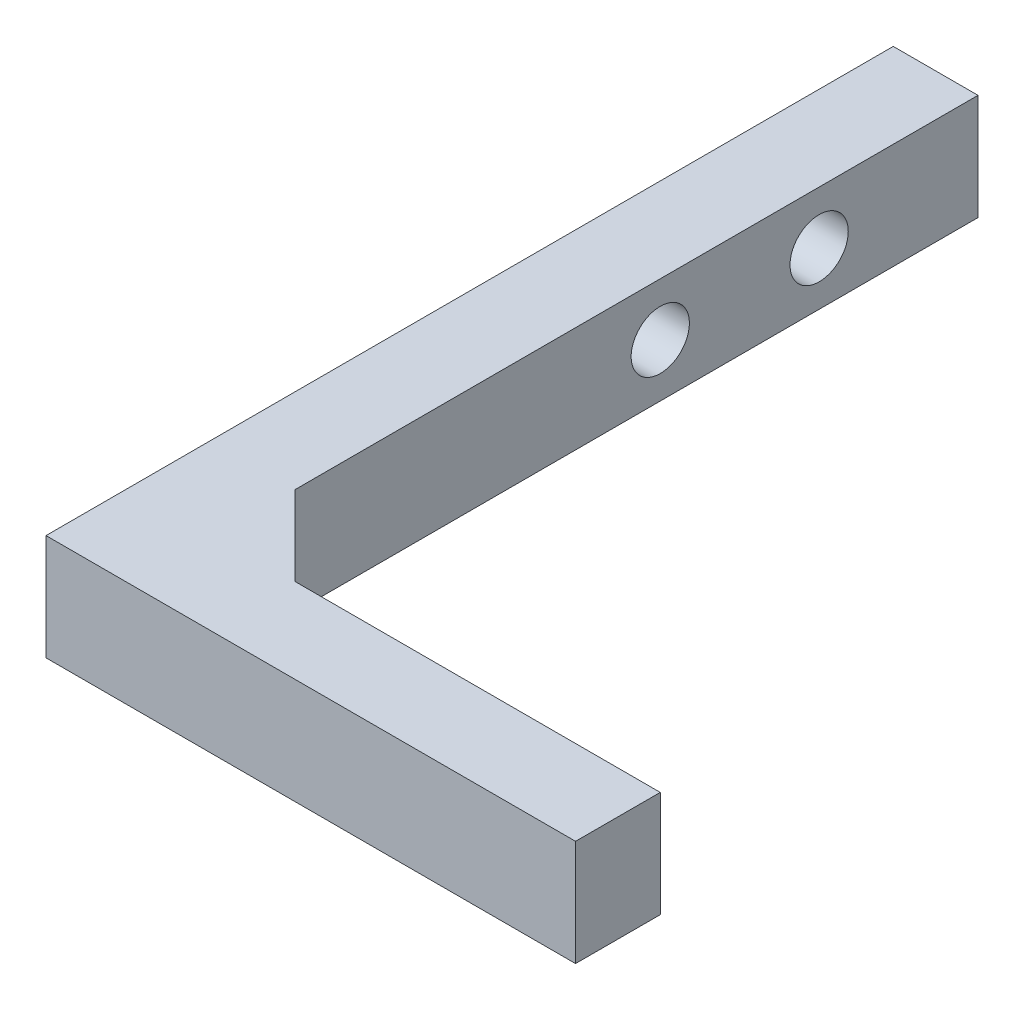
from build123d import *

# Parameters (mm, degrees)
EXTRUDE_1_DEPTH     = 10
CHAMFER_1_SIZE      = 7.5
SKETCH_2_R          = 2.75
CUT_EXTRUDE_1_DEPTH = 80.959868111


with BuildPart() as part:
    # 草图1 → 凸台-拉伸1 (new body)
    with BuildSketch(Plane(origin=(0, 0, 0), x_dir=(1, 0, 0), z_dir=(0, 1, 0))):
        Polygon((-10.992805755, 67.302158273), (-18.992805755, 67.302158273), (-18.992805755, -4.697841727), (-18.992805755, -12.697841727), (-10.992805755, -12.697841727), (31.007194245, -12.697841727), (31.007194245, -4.697841727), (-10.992805755, -4.697841727), align=None)
    extrude(amount=EXTRUDE_1_DEPTH)

    # 倒角1
    chamfer_1_edges = [part.edges().sort_by_distance(p)[0] for p in [
        (-10.992805755, 5, 4.697841727),
    ]]
    chamfer(chamfer_1_edges, length=CHAMFER_1_SIZE)

    # 草图2 → 切除-拉伸1 (cut, through all)
    with BuildSketch(Plane(origin=(-10.992805755, 0, 0), x_dir=(0, 0, -1), z_dir=(1, 0, 0))):
        with Locations((37.302158273, 5)):
            Circle(SKETCH_2_R)
        with Locations((52.302158273, 5)):
            Circle(SKETCH_2_R)
    extrude(amount=-CUT_EXTRUDE_1_DEPTH, mode=Mode.SUBTRACT)


solid = part.part
